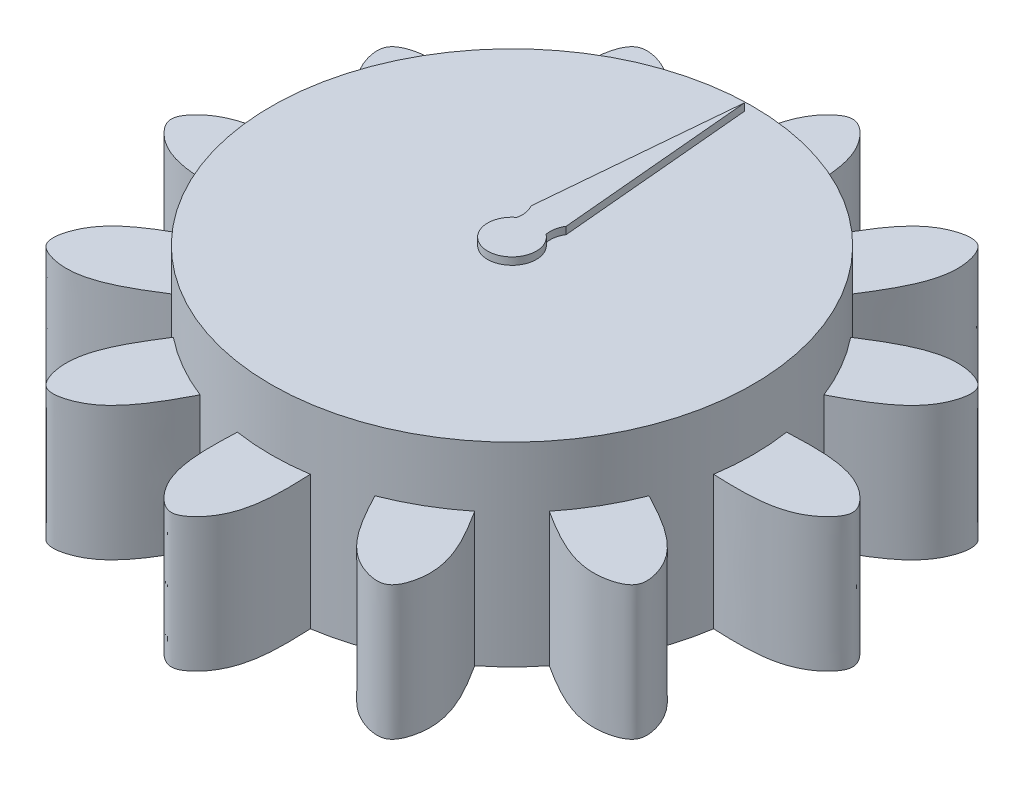
from build123d import *

# Parameters (mm, degrees)
SKETCH1_R           = 9.9
BOSS_EXTRUDE1_DEPTH = 6
SKETCH2_R           = 9.9
BOSS_EXTRUDE2_DEPTH = 2
BOSS_EXTRUDE3_DEPTH = 0.3
BOSS_EXTRUDE5_DEPTH = 5.5
CIRPATTERN1_COUNT   = 12


with BuildPart() as part:
    # Sketch1 → Boss-Extrude1 (new body)
    with BuildSketch(Plane(origin=(0, 0, 0), x_dir=(1, 0, 0), z_dir=(0, 1, 0))):
        with Locations(Location((0, 0, 0), (0, 0, 270))):
            Circle(SKETCH1_R)
    extrude(amount=BOSS_EXTRUDE1_DEPTH)

    # Sketch2 → Boss-Extrude2 (add)
    with BuildSketch(Plane(origin=(0, 6, 0), x_dir=(1, 0, 0), z_dir=(0, 1, 0))):
        with Locations(Location((0, 0, 0), (0, 0, 270))):
            Circle(SKETCH2_R)
    extrude(amount=BOSS_EXTRUDE2_DEPTH)

    # Sketch3 → Boss-Extrude3 (add)
    with BuildSketch(Plane(origin=(0, 8, 0), x_dir=(1, 0, 0), z_dir=(0, 1, 0))):
        with BuildLine():
            Line((0, 9.561873975), (0.727858815, 1.5))
            ThreePointArc((0.727858815, 1.5), (0.597494474, 1.162134703), (0.6, 0.8))
            ThreePointArc((0.6, 0.8), (0, -1), (-0.6, 0.8))
            ThreePointArc((-0.6, 0.8), (-0.592381481, 1.161228328), (-0.71735976, 1.500233309))
            Line((-0.71735976, 1.500233309), (0, 9.561873975))
        make_face()
    extrude(amount=BOSS_EXTRUDE3_DEPTH)

    # Sketch4 → Boss-Extrude5 (add)
    with BuildSketch(Plane.XZ):
        with BuildLine():
            Line((-1.5, -9.785703858), (1.5, -9.785703858))
            add(Edge.make_bspline(
                [(1.5, -9.785703858), (1.52233311, -10.350909106), (1.574363817, -11.667699624), (1.199302648, -13.281179815), (0, -14.188968688), (-1.199302648, -13.281179815), (-1.574363817, -11.667699624), (-1.52233311, -10.350909106), (-1.5, -9.785703858)],
                knots=[0, 0, 0, 0, 0.178316257, 0.415433434, 0.5, 0.584566566, 0.821683743, 1, 1, 1, 1], degree=3))
        make_face()
    boss_extrude5 = extrude(amount=-BOSS_EXTRUDE5_DEPTH)

    # CirPattern1: Boss-Extrude5 ×12 about axis
    cirpattern1_axis = Axis((0, 0, 0), (0, 1, 0))
    for i in range(1, CIRPATTERN1_COUNT):
        add(boss_extrude5.rotate(cirpattern1_axis, i * 360 / CIRPATTERN1_COUNT))


solid = part.part
